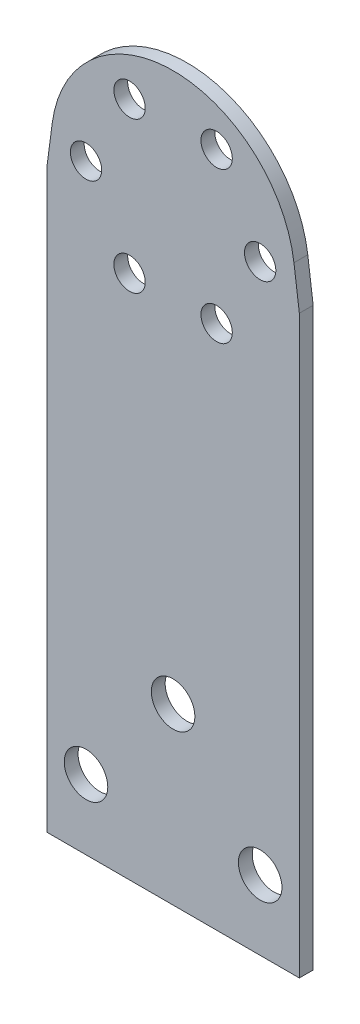
from build123d import *

# Parameters (mm, degrees)
SKETCH1_R            = 14
BOSS_EXTRUDE1_DEPTH  = 0.79375
SKETCH2_R            = 2.5
BOSS_EXTRUDE2_DEPTH  = 1.5875
M3_CLEARANCE_HOLE1_D = 3.6
CUT_EXTRUDE1_START   = -10
CUT_EXTRUDE1_DEPTH   = 10


with BuildPart() as part:
    # Sketch1 → Boss-Extrude1 (new, symmetric)
    with BuildSketch(Plane.XY):
        Circle(SKETCH1_R)
    extrude(amount=BOSS_EXTRUDE1_DEPTH, both=True)

    # Sketch2 → Boss-Extrude2 (add, through all)
    with BuildSketch(Plane.XY.offset(0.79375)):
        with BuildLine():
            Line((-13.880322311, 1.826650632), (-22.457257968, -63.347624774))
            ThreePointArc((-22.457257968, -63.347624774), (-21.259114, -67.29682604), (-17.5, -69))
            Line((-17.5, -69), (17.5, -69))
            ThreePointArc((17.5, -69), (21.259114, -67.29682604), (22.457257968, -63.347624774))
            Line((22.457257968, -63.347624774), (13.880322311, 1.826650632))
            Line((13.880322311, 1.826650632), (-13.880322311, 1.826650632))
        make_face()
        with Locations((-10, -61)):
            Circle(SKETCH2_R, mode=Mode.SUBTRACT)
        with Locations((10, -61)):
            Circle(SKETCH2_R, mode=Mode.SUBTRACT)
        with Locations((0, -49)):
            Circle(SKETCH2_R, mode=Mode.SUBTRACT)
    extrude(amount=-BOSS_EXTRUDE2_DEPTH)

    # M3 Clearance Hole1 (through all)
    with Locations(Plane.XY.offset(0.79375)):
        with Locations((5, 8.660254038), (-5, 8.660254038), (-10, 0), (-5, -8.660254038), (5, -8.660254038), (10, 0)):
            Hole(M3_CLEARANCE_HOLE1_D / 2)

    # Sketch5 → Cut-Extrude1 (cut)
    with BuildSketch(Plane(origin=(0, 0, -0.79375), x_dir=(-1, 0, 0), z_dir=(0, 0, -1)).offset(CUT_EXTRUDE1_START)):
        with BuildLine():
            Line((-14.5, -69), (-14.5, -2.882145837))
            Line((-14.5, -2.882145837), (-22.457257968, -63.347624774))
            ThreePointArc((-22.457257968, -63.347624774), (-21.259114, -67.29682604), (-17.5, -69))
            Line((-17.5, -69), (-14.5, -69))
        make_face()
        with BuildLine():
            Line((22.457257968, -63.347624774), (14.5, -2.882145837))
            Line((14.5, -2.882145837), (14.5, -69))
            Line((14.5, -69), (17.5, -69))
            ThreePointArc((17.5, -69), (21.259114, -67.29682604), (22.457257968, -63.347624774))
        make_face()
    extrude(amount=CUT_EXTRUDE1_DEPTH, mode=Mode.SUBTRACT)


solid = part.part
